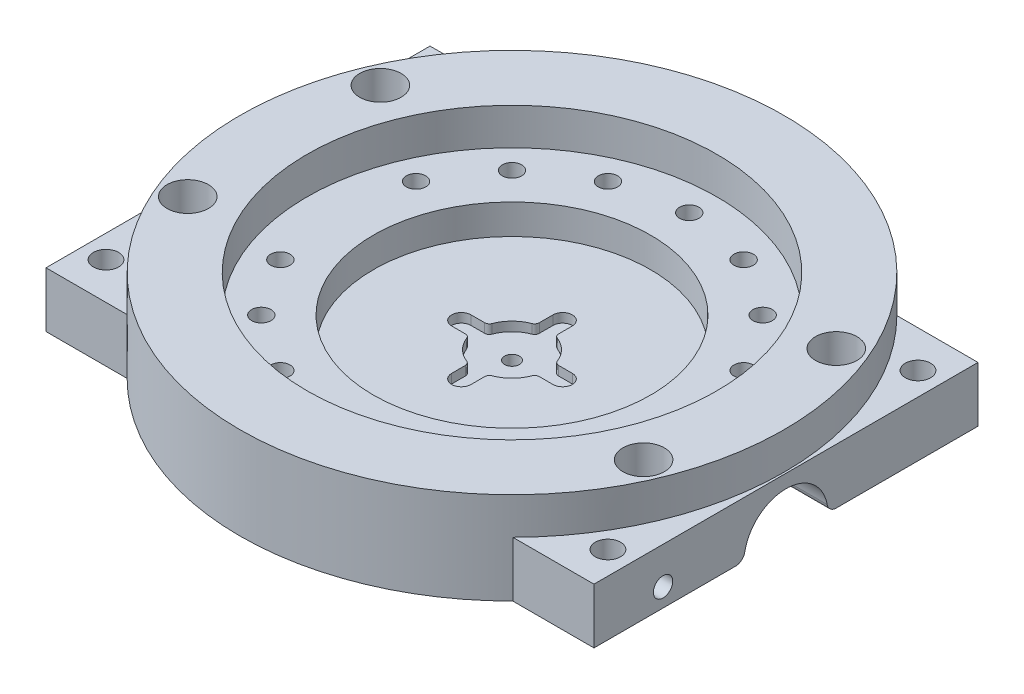
from build123d import *

# Parameters (mm, degrees)
SKETCH_1_R           = 59.5
EXTRUDE_1_DEPTH      = 20
SKETCH_2_R           = 44.5
CUT_EXTRUDE_1_DEPTH  = 8
SKETCH_3_R           = 30.1
CUT_EXTRUDE_2_DEPTH  = 6.5
SKETCH_4_R           = 2.1
CUT_EXTRUDE_3_DEPTH  = 87.489883802
SKETCH_5_R           = 3.75
CUT_EXTRUDE_4_DEPTH  = 5
SKETCH_26_R          = 3.1
CUT_EXTRUDE_14_DEPTH = 1.2
EXTRUDE_2_DEPTH      = 12
SKETCH_28_R          = 9.1
CUT_EXTRUDE_15_DEPTH = 23
FILLET_2_R           = 2
CUT_EXTRUDE_START    = -23
SKETCH_29_R          = 9.1
CUT_EXTRUDE_16_DEPTH = 23
FILLET_3_R           = 2
CUT_EXTRUDE_18_REACH = 88.49
SKETCH_31_R          = 2.75
SKETCH_32_R          = 2.1
CUT_EXTRUDE_19_DEPTH = 10
SKETCH_33_R          = 4.5
CUT_EXTRUDE_20_DEPTH = 8
CUT_EXTRUDE_START_2  = -8
CUT_EXTRUDE_22_DEPTH = 8
CUT_EXTRUDE_23_DEPTH = 2
FILLET_4_R           = 1
SKETCH_38_R          = 1.6
CUT_EXTRUDE_24_DEPTH = 87.220299234
CUT_EXTRUDE_25_DEPTH = 87.489883802


with BuildPart() as part:
    # 草图1 → 凸台-拉伸1 (new body)
    with BuildSketch(Plane(origin=(0, 0, 0), x_dir=(1, 0, 0), z_dir=(0, 1, 0))):
        with Locations(Location((0, 0, 0), (0, 0, 270))):
            Circle(SKETCH_1_R)
    extrude(amount=EXTRUDE_1_DEPTH)

    # 草图2 → 切除-拉伸1 (cut)
    with BuildSketch(Plane(origin=(0, 20, 0), x_dir=(1, 0, 0), z_dir=(0, 1, 0))):
        with Locations(Location((0, 0, 0), (0, 0, 270))):
            Circle(SKETCH_2_R)
    extrude(amount=-CUT_EXTRUDE_1_DEPTH, mode=Mode.SUBTRACT)

    # 草图3 → 切除-拉伸2 (cut)
    with BuildSketch(Plane(origin=(0, 12, 0), x_dir=(1, 0, 0), z_dir=(0, 1, 0))):
        with Locations(Location((0, 0, 0), (0, 0, 270))):
            Circle(SKETCH_3_R)
    extrude(amount=-CUT_EXTRUDE_2_DEPTH, mode=Mode.SUBTRACT)

    # 草图4 → 切除-拉伸3 (cut, through all)
    with BuildSketch(Plane.XZ):
        with Locations(Location((0, 38.5, 0), (0, 0, 270))):
            Circle(SKETCH_4_R)
        with Locations(Location((14.733312146, 35.569362002, 0), (0, 0, 270))):
            Circle(SKETCH_4_R)
        with Locations(Location((27.223611076, 27.223611076, 0), (0, 0, 270))):
            Circle(SKETCH_4_R)
        with Locations(Location((35.569362002, 14.733312146, 0), (0, 0, 270))):
            Circle(SKETCH_4_R)
        with Locations(Location((35.569362002, -14.733312146, 0), (0, 0, 270))):
            Circle(SKETCH_4_R)
        with Locations(Location((27.223611076, -27.223611076, 0), (0, 0, 270))):
            Circle(SKETCH_4_R)
        with Locations(Location((14.733312146, -35.569362002, 0), (0, 0, 270))):
            Circle(SKETCH_4_R)
        with Locations(Location((0, -38.5, 0), (0, 0, 270))):
            Circle(SKETCH_4_R)
        with Locations(Location((-14.733312146, -35.569362002, 0), (0, 0, 270))):
            Circle(SKETCH_4_R)
        with Locations(Location((-27.223611076, -27.223611076, 0), (0, 0, 270))):
            Circle(SKETCH_4_R)
        with Locations(Location((-35.569362002, -14.733312146, 0), (0, 0, 270))):
            Circle(SKETCH_4_R)
        with Locations(Location((-35.569362002, 14.733312146, 0), (0, 0, 270))):
            Circle(SKETCH_4_R)
        with Locations(Location((-27.223611076, 27.223611076, 0), (0, 0, 270))):
            Circle(SKETCH_4_R)
        with Locations(Location((-14.733312146, 35.569362002, 0), (0, 0, 270))):
            Circle(SKETCH_4_R)
    extrude(amount=-CUT_EXTRUDE_3_DEPTH, mode=Mode.SUBTRACT)

    # 草图5 → 切除-拉伸4 (cut)
    with BuildSketch(Plane.XZ):
        with Locations(Location((0, 38.5, 0), (0, 0, 270))):
            Circle(SKETCH_5_R)
        with Locations(Location((14.733312146, 35.569362002, 0), (0, 0, 270))):
            Circle(SKETCH_5_R)
        with Locations(Location((27.223611076, 27.223611076, 0), (0, 0, 270))):
            Circle(SKETCH_5_R)
        with Locations(Location((35.569362002, 14.733312146, 0), (0, 0, 270))):
            Circle(SKETCH_5_R)
        with Locations(Location((35.569362002, -14.733312146, 0), (0, 0, 270))):
            Circle(SKETCH_5_R)
        with Locations(Location((27.223611076, -27.223611076, 0), (0, 0, 270))):
            Circle(SKETCH_5_R)
        with Locations(Location((14.733312146, -35.569362002, 0), (0, 0, 270))):
            Circle(SKETCH_5_R)
        with Locations(Location((0, -38.5, 0), (0, 0, 270))):
            Circle(SKETCH_5_R)
        with Locations(Location((-14.733312146, -35.569362002, 0), (0, 0, 270))):
            Circle(SKETCH_5_R)
        with Locations(Location((-27.223611076, -27.223611076, 0), (0, 0, 270))):
            Circle(SKETCH_5_R)
        with Locations(Location((-35.569362002, -14.733312146, 0), (0, 0, 270))):
            Circle(SKETCH_5_R)
        with Locations(Location((-35.569362002, 14.733312146, 0), (0, 0, 270))):
            Circle(SKETCH_5_R)
        with Locations(Location((-27.223611076, 27.223611076, 0), (0, 0, 270))):
            Circle(SKETCH_5_R)
        with Locations(Location((-14.733312146, 35.569362002, 0), (0, 0, 270))):
            Circle(SKETCH_5_R)
    extrude(amount=-CUT_EXTRUDE_4_DEPTH, mode=Mode.SUBTRACT)

    # 草图26 → 切除-拉伸14 (cut)
    with BuildSketch(Plane.XZ):
        with Locations(Location((0, 0, 0), (0, 0, 270))):
            Circle(SKETCH_26_R)
    extrude(amount=-CUT_EXTRUDE_14_DEPTH, mode=Mode.SUBTRACT)

    # 草图27 → 凸台-拉伸2 (add)
    with BuildSketch(Plane.XZ):
        with BuildLine():
            Line((-59.5, 41.7), (-59.5, 0))
            ThreePointArc((-59.5, 0), (-55.070748497, 22.52693188), (-42.442431599, 41.7))
            Line((-42.442431599, 41.7), (-59.5, 41.7))
        make_face()
        with BuildLine():
            Line((-59.5, 0), (-59.5, -41.7))
            Line((-59.5, -41.7), (-42.442431599, -41.7))
            ThreePointArc((-42.442431599, -41.7), (-55.070748497, -22.52693188), (-59.5, 0))
        make_face()
        with BuildLine():
            ThreePointArc((42.442431599, 41.7), (55.070748497, 22.52693188), (59.5, 0))
            Line((59.5, 0), (59.5, 41.7))
            Line((59.5, 41.7), (42.442431599, 41.7))
        make_face()
        with BuildLine():
            Line((42.442431599, -41.7), (59.5, -41.7))
            Line((59.5, -41.7), (59.5, 0))
            ThreePointArc((59.5, 0), (55.070748497, -22.52693188), (42.442431599, -41.7))
        make_face()
    extrude(amount=-EXTRUDE_2_DEPTH)

    # 草图28 → 切除-拉伸15 (cut)
    with BuildSketch(Plane.ZY.offset(59.5)):
        Circle(SKETCH_28_R)
    extrude(amount=-CUT_EXTRUDE_15_DEPTH, mode=Mode.SUBTRACT)

    # 圆角2
    fillet_2_edges = [part.edges().sort_by_distance(p)[0] for p in [
        (-48, 0, -9.1),
        (-48, 0, 9.1),
    ]]
    fillet(fillet_2_edges, radius=FILLET_2_R)

    # 草图29 → 切除-拉伸16 (cut)
    with BuildSketch(Plane(origin=(59.5, 0, 0), x_dir=(0, 0, -1), z_dir=(1, 0, 0)).offset(CUT_EXTRUDE_START)):
        Circle(SKETCH_29_R)
    extrude(amount=CUT_EXTRUDE_16_DEPTH, mode=Mode.SUBTRACT)

    # 圆角3
    fillet_3_edges = [part.edges().sort_by_distance(p)[0] for p in [
        (48, 0, 9.1),
        (48, 0, -9.1),
    ]]
    fillet(fillet_3_edges, radius=FILLET_3_R)

    # 草图31 → 切除-拉伸18 (cut, up to next)
    with BuildSketch(Plane(origin=(0, 20, 0), x_dir=(1, 0, 0), z_dir=(0, 1, 0)), mode=Mode.PRIVATE) as cut_extrude_18_sk1:
        with Locations(Location((54.5, 33.667083302, 0), (0, 0, 270))):
            Circle(SKETCH_31_R)
    cut_extrude_18_tool1 = extrude(cut_extrude_18_sk1.sketch, amount=-CUT_EXTRUDE_18_REACH, mode=Mode.PRIVATE) & part.part
    # 草图31 → 切除-拉伸18 (cut, up to next)
    with BuildSketch(Plane(origin=(0, 20, 0), x_dir=(1, 0, 0), z_dir=(0, 1, 0)), mode=Mode.PRIVATE) as cut_extrude_18_sk2:
        with Locations(Location((49.5, 20.918333206, 0), (0, 0, 270))):
            Circle(SKETCH_31_R)
    cut_extrude_18_tool2 = extrude(cut_extrude_18_sk2.sketch, amount=-CUT_EXTRUDE_18_REACH, mode=Mode.PRIVATE) & part.part
    # 草图31 → 切除-拉伸18 (cut, up to next)
    with BuildSketch(Plane(origin=(0, 20, 0), x_dir=(1, 0, 0), z_dir=(0, 1, 0)), mode=Mode.PRIVATE) as cut_extrude_18_sk3:
        with Locations(Location((49.5, -20.918333206, 0), (0, 0, 270))):
            Circle(SKETCH_31_R)
    cut_extrude_18_tool3 = extrude(cut_extrude_18_sk3.sketch, amount=-CUT_EXTRUDE_18_REACH, mode=Mode.PRIVATE) & part.part
    # 草图31 → 切除-拉伸18 (cut, up to next)
    with BuildSketch(Plane(origin=(0, 20, 0), x_dir=(1, 0, 0), z_dir=(0, 1, 0)), mode=Mode.PRIVATE) as cut_extrude_18_sk4:
        with Locations(Location((54.5, -33.667083302, 0), (0, 0, 270))):
            Circle(SKETCH_31_R)
    cut_extrude_18_tool4 = extrude(cut_extrude_18_sk4.sketch, amount=-CUT_EXTRUDE_18_REACH, mode=Mode.PRIVATE) & part.part
    # 草图31 → 切除-拉伸18 (cut, up to next)
    with BuildSketch(Plane(origin=(0, 20, 0), x_dir=(1, 0, 0), z_dir=(0, 1, 0)), mode=Mode.PRIVATE) as cut_extrude_18_sk5:
        with Locations(Location((-54.5, -33.667083302, 0), (0, 0, 270))):
            Circle(SKETCH_31_R)
    cut_extrude_18_tool5 = extrude(cut_extrude_18_sk5.sketch, amount=-CUT_EXTRUDE_18_REACH, mode=Mode.PRIVATE) & part.part
    # 草图31 → 切除-拉伸18 (cut, up to next)
    with BuildSketch(Plane(origin=(0, 20, 0), x_dir=(1, 0, 0), z_dir=(0, 1, 0)), mode=Mode.PRIVATE) as cut_extrude_18_sk6:
        with Locations(Location((-49.5, -20.918333206, 0), (0, 0, 270))):
            Circle(SKETCH_31_R)
    cut_extrude_18_tool6 = extrude(cut_extrude_18_sk6.sketch, amount=-CUT_EXTRUDE_18_REACH, mode=Mode.PRIVATE) & part.part
    # 草图31 → 切除-拉伸18 (cut, up to next)
    with BuildSketch(Plane(origin=(0, 20, 0), x_dir=(1, 0, 0), z_dir=(0, 1, 0)), mode=Mode.PRIVATE) as cut_extrude_18_sk7:
        with Locations(Location((-49.5, 20.918333206, 0), (0, 0, 270))):
            Circle(SKETCH_31_R)
    cut_extrude_18_tool7 = extrude(cut_extrude_18_sk7.sketch, amount=-CUT_EXTRUDE_18_REACH, mode=Mode.PRIVATE) & part.part
    # 草图31 → 切除-拉伸18 (cut, up to next)
    with BuildSketch(Plane(origin=(0, 20, 0), x_dir=(1, 0, 0), z_dir=(0, 1, 0)), mode=Mode.PRIVATE) as cut_extrude_18_sk8:
        with Locations(Location((-54.5, 33.667083302, 0), (0, 0, 270))):
            Circle(SKETCH_31_R)
    cut_extrude_18_tool8 = extrude(cut_extrude_18_sk8.sketch, amount=-CUT_EXTRUDE_18_REACH, mode=Mode.PRIVATE) & part.part
    add(cut_extrude_18_tool1.solids().sort_by_distance((54.5, 20, -33.667083))[0], mode=Mode.SUBTRACT)
    add(cut_extrude_18_tool2.solids().sort_by_distance((49.5, 20, -20.918333))[0], mode=Mode.SUBTRACT)
    add(cut_extrude_18_tool3.solids().sort_by_distance((49.5, 20, 20.918333))[0], mode=Mode.SUBTRACT)
    add(cut_extrude_18_tool4.solids().sort_by_distance((54.5, 20, 33.667083))[0], mode=Mode.SUBTRACT)
    add(cut_extrude_18_tool5.solids().sort_by_distance((-54.5, 20, 33.667083))[0], mode=Mode.SUBTRACT)
    add(cut_extrude_18_tool6.solids().sort_by_distance((-49.5, 20, 20.918333))[0], mode=Mode.SUBTRACT)
    add(cut_extrude_18_tool7.solids().sort_by_distance((-49.5, 20, -20.918333))[0], mode=Mode.SUBTRACT)
    add(cut_extrude_18_tool8.solids().sort_by_distance((-54.5, 20, -33.667083))[0], mode=Mode.SUBTRACT)

    # 草图32 → 切除-拉伸19 (cut)
    with BuildSketch(Plane.ZY.offset(59.5)):
        with Locations((26.7, 4)):
            Circle(SKETCH_32_R)
    cut_extrude_19 = extrude(amount=-CUT_EXTRUDE_19_DEPTH, mode=Mode.SUBTRACT)

    # 草图33 → 切除-拉伸20 (cut)
    with BuildSketch(Plane(origin=(0, 20, 0), x_dir=(1, 0, 0), z_dir=(0, 1, 0))):
        with Locations(Location((-49.5, 20.918333206, 0), (0, 0, 270))):
            Circle(SKETCH_33_R)
        with Locations(Location((-49.5, -20.918333206, 0), (0, 0, 270))):
            Circle(SKETCH_33_R)
        with Locations(Location((49.5, 20.918333206, 0), (0, 0, 270))):
            Circle(SKETCH_33_R)
        with Locations(Location((49.5, -20.918333206, 0), (0, 0, 270))):
            Circle(SKETCH_33_R)
    extrude(amount=-CUT_EXTRUDE_20_DEPTH, mode=Mode.SUBTRACT)

    # 草图34 → 切除-拉伸22 (cut)
    with BuildSketch(Plane(origin=(0, 20, 0), x_dir=(1, 0, 0), z_dir=(0, 1, 0)).offset(CUT_EXTRUDE_START_2)):
        with BuildLine():
            Line((-42.442431599, 41.7), (-41.87982808, 41.7))
            ThreePointArc((-41.87982808, 41.7), (-59.1, 0), (-41.87982808, -41.7))
            Line((-41.87982808, -41.7), (-42.442431599, -41.7))
            ThreePointArc((-42.442431599, -41.7), (-59.5, 0), (-42.442431599, 41.7))
        make_face()
        with BuildLine():
            Line((41.87982808, -41.7), (42.442431599, -41.7))
            ThreePointArc((42.442431599, -41.7), (59.5, 0), (42.442431599, 41.7))
            Line((42.442431599, 41.7), (41.87982808, 41.7))
            ThreePointArc((41.87982808, 41.7), (59.1, 0), (41.87982808, -41.7))
        make_face()
    extrude(amount=CUT_EXTRUDE_22_DEPTH, mode=Mode.SUBTRACT)

    # 镜向1: 切除-拉伸19 across plane
    add(cut_extrude_19.mirror(Plane(origin=(0, 0, 0), x_dir=(0, 0, 1), z_dir=(1, 0, 0))), mode=Mode.SUBTRACT)

    # 草图37 → 切除-拉伸23 (cut)
    with BuildSketch(Plane(origin=(-2.468226957, 5.5, -11.643592384), x_dir=(1, 0, 0), z_dir=(0, 1, 0))):
        with BuildLine():
            Line((0.368226957, -0.643592384), (0.368226957, -4.339483951))
            ThreePointArc((0.368226957, -4.339483951), (2.468226957, -4.043592384), (4.568226957, -4.339483951))
            Line((4.568226957, -4.339483951), (4.568226957, -0.643592384))
            ThreePointArc((4.568226957, -0.643592384), (2.468226957, 1.456407616), (0.368226957, -0.643592384))
        make_face()
        with BuildLine():
            ThreePointArc((4.568226957, -6.643592384), (2.468226957, -8.743592384), (0.368226957, -6.643592384))
            Line((0.368226957, -6.643592384), (0.368226957, -4.339483951))
            ThreePointArc((0.368226957, -4.339483951), (-2.90578458, -6.269580847), (-4.835881476, -9.543592384))
            Line((-4.835881476, -9.543592384), (-2.531773043, -9.543592384))
            ThreePointArc((-2.531773043, -9.543592384), (-0.431773043, -11.643592384), (-2.531773043, -13.743592384))
            Line((-2.531773043, -13.743592384), (-4.835881476, -13.743592384))
            ThreePointArc((-4.835881476, -13.743592384), (-2.90578458, -17.017603921), (0.368226957, -18.947700817))
            Line((0.368226957, -18.947700817), (0.368226957, -16.643592384))
            ThreePointArc((0.368226957, -16.643592384), (2.468226957, -14.543592384), (4.568226957, -16.643592384))
            Line((4.568226957, -16.643592384), (4.568226957, -18.947700817))
            ThreePointArc((4.568226957, -18.947700817), (7.842238494, -17.017603921), (9.77233539, -13.743592384))
            Line((9.77233539, -13.743592384), (7.468226957, -13.743592384))
            ThreePointArc((7.468226957, -13.743592384), (5.368226957, -11.643592384), (7.468226957, -9.543592384))
            Line((7.468226957, -9.543592384), (9.77233539, -9.543592384))
            ThreePointArc((9.77233539, -9.543592384), (7.842238494, -6.269580847), (4.568226957, -4.339483951))
            Line((4.568226957, -4.339483951), (4.568226957, -6.643592384))
        make_face()
        with BuildLine():
            ThreePointArc((-4.835881476, -13.743592384), (-5.131773043, -11.643592384), (-4.835881476, -9.543592384))
            Line((-4.835881476, -9.543592384), (-8.531773043, -9.543592384))
            ThreePointArc((-8.531773043, -9.543592384), (-10.631773043, -11.643592384), (-8.531773043, -13.743592384))
            Line((-8.531773043, -13.743592384), (-4.835881476, -13.743592384))
        make_face()
        with BuildLine():
            ThreePointArc((4.568226957, -18.947700817), (2.468226957, -19.243592384), (0.368226957, -18.947700817))
            Line((0.368226957, -18.947700817), (0.368226957, -22.643592384))
            ThreePointArc((0.368226957, -22.643592384), (2.468226957, -24.743592384), (4.568226957, -22.643592384))
            Line((4.568226957, -22.643592384), (4.568226957, -18.947700817))
        make_face()
        with BuildLine():
            Line((13.468226957, -9.543592384), (9.77233539, -9.543592384))
            ThreePointArc((9.77233539, -9.543592384), (9.993890519, -10.583220773), (10.068226957, -11.643592384))
            ThreePointArc((10.068226957, -11.643592384), (9.993890519, -12.703963996), (9.77233539, -13.743592384))
            Line((9.77233539, -13.743592384), (13.468226957, -13.743592384))
            ThreePointArc((13.468226957, -13.743592384), (15.568226957, -11.643592384), (13.468226957, -9.543592384))
        make_face()
        with BuildLine():
            Line((0.368226957, -4.339483951), (0.368226957, -6.643592384))
            ThreePointArc((0.368226957, -6.643592384), (2.468226957, -8.743592384), (4.568226957, -6.643592384))
            Line((4.568226957, -6.643592384), (4.568226957, -4.339483951))
            ThreePointArc((4.568226957, -4.339483951), (2.468226957, -4.043592384), (0.368226957, -4.339483951))
        make_face()
        with BuildLine():
            Line((-2.531773043, -9.543592384), (-4.835881476, -9.543592384))
            ThreePointArc((-4.835881476, -9.543592384), (-5.131773043, -11.643592384), (-4.835881476, -13.743592384))
            Line((-4.835881476, -13.743592384), (-2.531773043, -13.743592384))
            ThreePointArc((-2.531773043, -13.743592384), (-0.431773043, -11.643592384), (-2.531773043, -9.543592384))
        make_face()
        with BuildLine():
            ThreePointArc((10.068226957, -11.643592384), (9.993890519, -10.583220773), (9.77233539, -9.543592384))
            Line((9.77233539, -9.543592384), (7.468226957, -9.543592384))
            ThreePointArc((7.468226957, -9.543592384), (5.368226957, -11.643592384), (7.468226957, -13.743592384))
            Line((7.468226957, -13.743592384), (9.77233539, -13.743592384))
            ThreePointArc((9.77233539, -13.743592384), (9.993890519, -12.703963996), (10.068226957, -11.643592384))
        make_face()
        with BuildLine():
            Line((0.368226957, -16.643592384), (0.368226957, -18.947700817))
            ThreePointArc((0.368226957, -18.947700817), (2.468226957, -19.243592384), (4.568226957, -18.947700817))
            Line((4.568226957, -18.947700817), (4.568226957, -16.643592384))
            ThreePointArc((4.568226957, -16.643592384), (2.468226957, -14.543592384), (0.368226957, -16.643592384))
        make_face()
    extrude(amount=-CUT_EXTRUDE_23_DEPTH, mode=Mode.SUBTRACT)

    # 圆角4
    fillet_4_edges = [part.edges().sort_by_distance(p)[0] for p in [
        (-7.304108433, 4.5, -2.1),
        (-2.1, 4.5, -7.304108433),
        (2.1, 4.5, -7.304108433),
        (7.304108433, 4.5, -2.1),
        (7.304108433, 4.5, 2.1),
        (2.1, 4.5, 7.304108433),
        (-2.1, 4.5, 7.304108433),
        (-7.304108433, 4.5, 2.1),
    ]]
    fillet(fillet_4_edges, radius=FILLET_4_R)

    # 草图38 → 切除-拉伸24 (cut, through all)
    with BuildSketch(Plane.XZ.offset(-1.2)):
        with Locations(Location((0, 0, 0), (0, 0, 270))):
            Circle(SKETCH_38_R)
    extrude(amount=-CUT_EXTRUDE_24_DEPTH, mode=Mode.SUBTRACT)

    # 草图39 → 切除-拉伸25 (cut, through all)
    with BuildSketch(Plane(origin=(0, 20, 0), x_dir=(1, 0, 0), z_dir=(0, 1, 0))):
        with BuildLine():
            Line((-42.442431599, 41.7), (-41.87982808, 41.7))
            ThreePointArc((-41.87982808, 41.7), (0, 59.1), (41.87982808, 41.7))
            Line((41.87982808, 41.7), (42.442431599, 41.7))
            ThreePointArc((42.442431599, 41.7), (0, 59.5), (-42.442431599, 41.7))
        make_face()
        with BuildLine():
            Line((-41.87982808, -41.7), (-42.442431599, -41.7))
            ThreePointArc((-42.442431599, -41.7), (0, -59.5), (42.442431599, -41.7))
            Line((42.442431599, -41.7), (41.87982808, -41.7))
            ThreePointArc((41.87982808, -41.7), (0, -59.1), (-41.87982808, -41.7))
        make_face()
    extrude(amount=-CUT_EXTRUDE_25_DEPTH, mode=Mode.SUBTRACT)


solid = part.part
